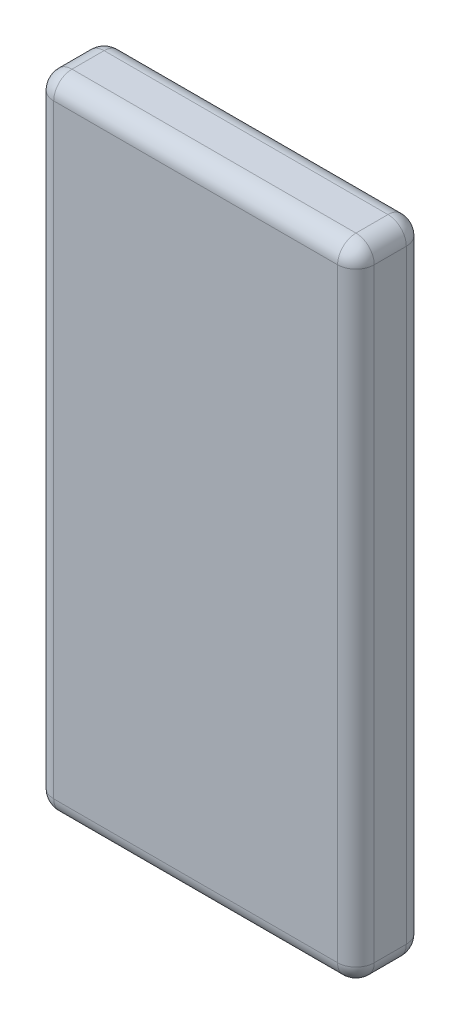
from build123d import *

# Parameters (mm, degrees)
ESQUISSE1_W        = 70
ESQUISSE1_H        = 140
BOSS_EXTRU_1_DEPTH = 15
CONG_1_R           = 4
CONG_2_R           = 4
CONG_3_R           = 4


with BuildPart() as part:
    # Esquisse1 → Boss.-Extru.1 (new body)
    with BuildSketch(Plane.XY):
        with Locations((-35, -70)):
            Rectangle(ESQUISSE1_W, ESQUISSE1_H)
    extrude(amount=BOSS_EXTRU_1_DEPTH)

    # Congé1
    cong_1_edges = [part.edges().sort_by_distance(p)[0] for p in [
        (0, -140, 7.5),
        (-70, -140, 7.5),
        (-70, 0, 7.5),
        (0, 0, 7.5),
    ]]
    fillet(cong_1_edges, radius=CONG_1_R)

    # Congé2
    cong_2_edges = [part.edges().sort_by_distance(p)[0] for p in [
        (0, -70, 15),
        (-35, -140, 15),
        (-35, 0, 15),
        (-70, -70, 15),
        (-1.171572875, -1.171572875, 15),
        (-68.828427125, -1.171572875, 15),
        (-68.828427125, -138.828427125, 15),
        (-1.171572875, -138.828427125, 15),
    ]]
    fillet(cong_2_edges, radius=CONG_2_R)

    # Congé3
    cong_3_edges = [part.edges().sort_by_distance(p)[0] for p in [
        (0, -70, 0),
        (-35, -140, 0),
        (-70, -70, 0),
        (-35, 0, 0),
        (-1.171572875, -1.171572875, 0),
        (-68.828427125, -1.171572875, 0),
        (-68.828427125, -138.828427125, 0),
        (-1.171572875, -138.828427125, 0),
    ]]
    fillet(cong_3_edges, radius=CONG_3_R)


solid = part.part
